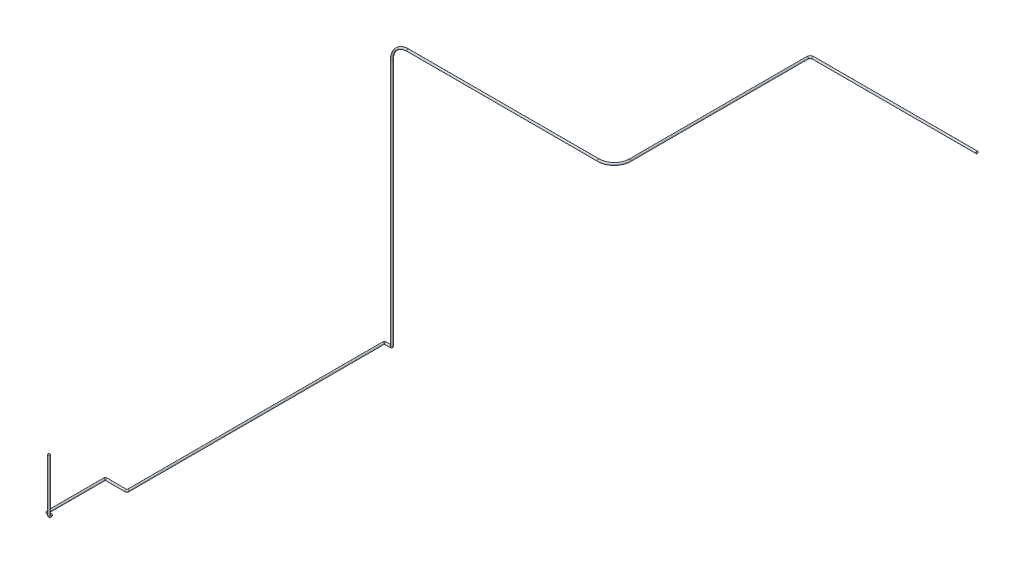
from build123d import *

# Parameters (mm, degrees)
CROQUIS2_R              = 18
SALIENTE_EXTRUIR1_DEPTH = 50
CROQUIS3_R              = 18


with BuildPart() as part:
    # Croquis2 → Saliente-Extruir1 (new body)
    with BuildSketch(Plane(origin=(0, 0, 0), x_dir=(1, 0, 0), z_dir=(0, 1, 0))):
        with Locations(Location((0, 0, 0), (0, 0, 270))):
            Circle(CROQUIS2_R)
    extrude(amount=-SALIENTE_EXTRUIR1_DEPTH)

    # Barrer1: sweep along a curve in space
    with BuildLine() as barrer1_path:
        Line((0, -50, 0), (0, -901, 0))
        ThreePointArc((0, -901, 0), (0, -914.435028843, -5.564971157), (0, -920, -19))
        Line((0, -920, -19), (0, -920, -21))
        ThreePointArc((0, -920, -21), (-5.564971157, -920, -34.435028843), (-19, -920, -40))
        Line((-19, -920, -40), (-61, -920, -40))
        ThreePointArc((-61, -920, -40), (-74.435028843, -920, -45.564971157), (-80, -920, -59))
        Line((-80, -920, -59), (-80, -920, -1021))
        ThreePointArc((-80, -920, -1021), (-74.435028843, -920, -1034.435028843), (-61, -920, -1040))
        Line((-61, -920, -1040), (271, -920, -1040))
        ThreePointArc((271, -920, -1040), (284.435028843, -920, -1045.564971157), (290, -920, -1059))
        Line((290, -920, -1059), (290, -920, -5421))
        ThreePointArc((290, -920, -5421), (295.564971157, -920, -5434.435028843), (309, -920, -5440))
        Line((309, -920, -5440), (401, -920, -5440))
        ThreePointArc((401, -920, -5440), (414.435028843, -914.435028843, -5440), (420, -901, -5440))
        Line((420, -901, -5440), (420, 3340, -5440))
        ThreePointArc((420, 3340, -5440), (499.08116908, 3530.91883092, -5440), (690, 3610, -5440))
        Line((690, 3610, -5440), (3950, 3610, -5440))
        ThreePointArc((3950, 3610, -5440), (4140.91883092, 3610, -5519.08116908), (4220, 3610, -5710))
        Line((4220, 3610, -5710), (4220, 3610, -8740))
        ThreePointArc((4220, 3610, -8740), (4234.644660941, 3610, -8775.355339059), (4270, 3610, -8790))
        Line((4270, 3610, -8790), (7070, 3610, -8790))
    # Croquis3 → Barrer1 (sweep)
    with BuildSketch(Plane.XZ.offset(50)):
        Circle(CROQUIS3_R)
    sweep(path=barrer1_path.line)


solid = part.part
